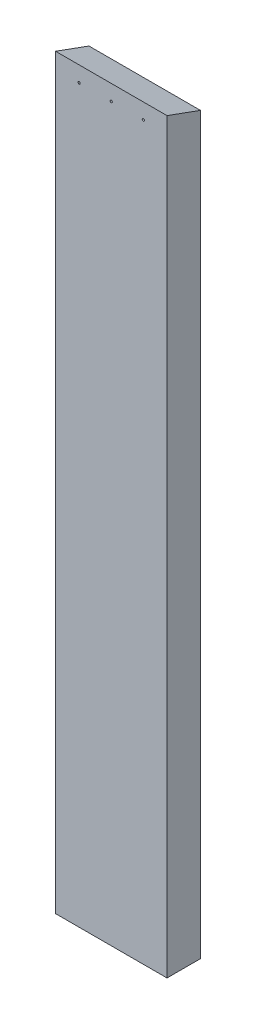
from build123d import *

# Parameters (mm, degrees)
SKETCH2_W               = 63.5
SKETCH2_H               = 19.05
BOSS_EXTRUDE1_DEPTH     = 425.45
CUT_EXTRUDE1_DEPTH      = 431.584318107
CUT_EXTRUDE1_DEPTH_BACK = 50.8
SKETCH3_R               = 0.635
SKETCH4_R               = 0.635
CUT_EXTRUDE2_DEPTH      = 431.584318107
CUT_EXTRUDE3_DEPTH      = 431.584318107


with BuildPart() as part:
    # Sketch2 → Boss-Extrude1 (new body)
    with BuildSketch(Plane(origin=(0, 0, 0), x_dir=(1, 0, 0), z_dir=(0, 1, 0))):
        with Locations((31.75, 9.525)):
            Rectangle(SKETCH2_W, SKETCH2_H)
    extrude(amount=BOSS_EXTRUDE1_DEPTH)

    # Sketch3 → Cut-Extrude1 (cut, two sides: drawn at the far end of the back side and taken through both)
    with BuildSketch(Plane.XZ.offset(-CUT_EXTRUDE1_DEPTH_BACK)):
        with Locations(Location((13.487400071, -9.524999694, 0), (0, 0, 270))):
            Circle(SKETCH3_R)
        with Locations(Location((31.750000071, -9.524999694, 0), (0, 0, 270))):
            Circle(SKETCH3_R)
        with Locations(Location((50.012600071, -9.524999694, 0), (0, 0, 270))):
            Circle(SKETCH3_R)
    extrude(amount=CUT_EXTRUDE1_DEPTH + CUT_EXTRUDE1_DEPTH_BACK, mode=Mode.SUBTRACT)

    # Sketch4 → Cut-Extrude2 (cut, through all)
    with BuildSketch(Plane.XY):
        with Locations((31.724600071, 416.56)):
            Circle(SKETCH4_R)
        with Locations((50.012600071, 416.56)):
            Circle(SKETCH4_R)
        with Locations(Location((13.436600071, 416.56, 0), (0, 0, 180))):
            Circle(SKETCH4_R)
    extrude(amount=-CUT_EXTRUDE2_DEPTH, mode=Mode.SUBTRACT)

    # Sketch5 → Cut-Extrude3 (cut, through all)
    with BuildSketch(Plane.ZY):
        Polygon((0, 425.45), (-19.05, 418.516367037), (-19.05, 425.45), align=None)
    extrude(amount=-CUT_EXTRUDE3_DEPTH, mode=Mode.SUBTRACT)


solid = part.part
